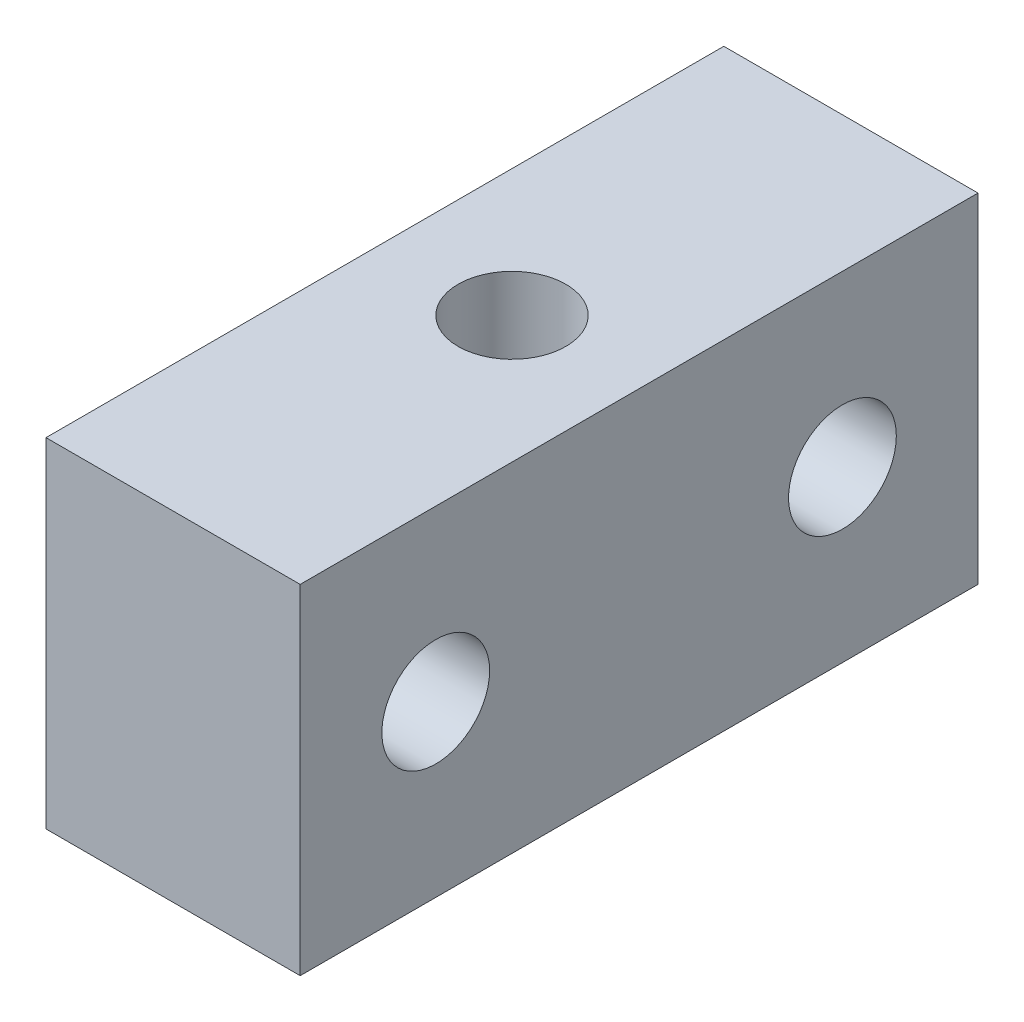
from build123d import *

# Parameters (mm, degrees)
SKETCH1_W              = 25.4
SKETCH1_H              = 12.7
BOSS_EXTRUDE1_DEPTH    = 4.7625
F_10_32_TAPPED_HOLE1_D = 4.0386
F_10_32_TAPPED_HOLE2_D = 4.0386


with BuildPart() as part:
    # Sketch1 → Boss-Extrude1 (new, symmetric)
    with BuildSketch(Plane(origin=(0, 0, 0), x_dir=(0, 0, -1), z_dir=(1, 0, 0))):
        Rectangle(SKETCH1_W, SKETCH1_H)
    extrude(amount=BOSS_EXTRUDE1_DEPTH, both=True)

    # #10-32 Tapped Hole1 (through all)
    with Locations(Plane(origin=(0, 6.35, 0), x_dir=(1, 0, 0), z_dir=(0, 1, 0))):
        with Locations((0, 0)):
            Hole(F_10_32_TAPPED_HOLE1_D / 2)

    # #10-32 Tapped Hole2 (through all)
    with Locations(Plane(origin=(4.7625, 0, 0), x_dir=(0, 0, -1), z_dir=(1, 0, 0))):
        with Locations((-7.62, 0), (7.62, 0)):
            Hole(F_10_32_TAPPED_HOLE2_D / 2)


solid = part.part
